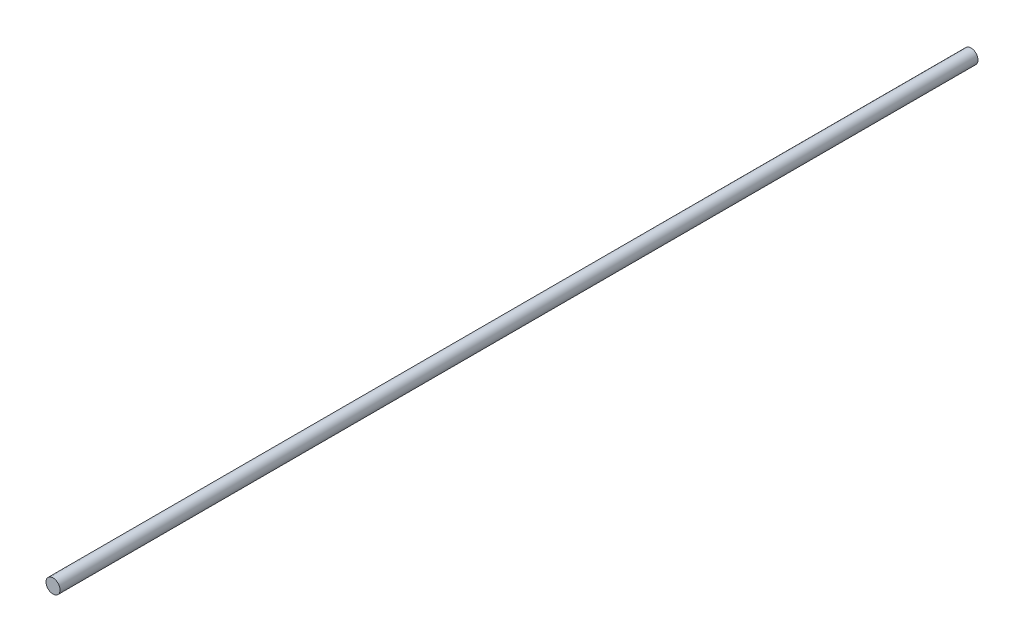
from build123d import *

# Parameters (mm, degrees)
SKETCH_1_R      = 2.5
EXTRUDE_1_DEPTH = 327


with BuildPart() as part:
    # 草图1 → 凸台-拉伸1 (new body)
    with BuildSketch(Plane.XY):
        Circle(SKETCH_1_R)
    extrude(amount=EXTRUDE_1_DEPTH)


solid = part.part
